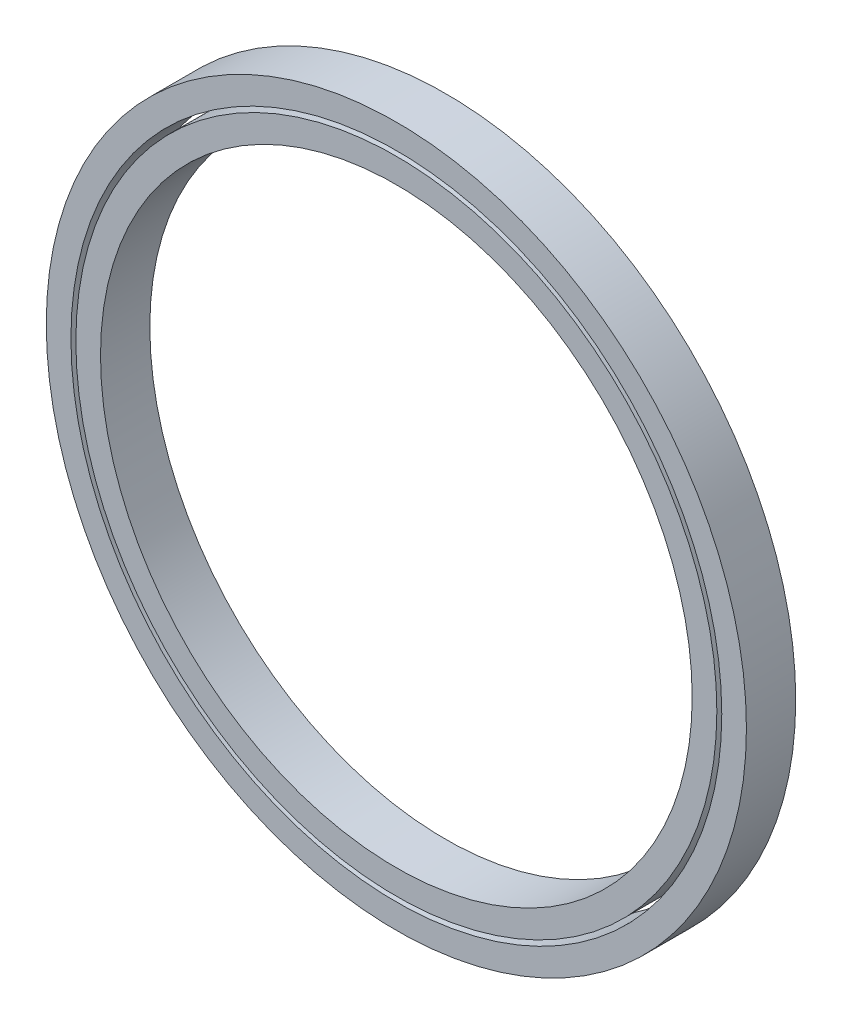
from build123d import *

# Parameters (mm, degrees)
SKETCH1_R             = 32.5
SKETCH1_R_2           = 30
BOSS_EXTRUDE1_DEPTH   = 2.5
SKETCH1_R_3           = 35.5
SKETCH1_R_4           = 33
BOSS_EXTRUDE1_2_DEPTH = 2.5


with BuildPart() as part:
    # Sketch1 → Boss-Extrude1 (new, symmetric)
    with BuildSketch(Plane.XY):
        Circle(SKETCH1_R)
        Circle(SKETCH1_R_2, mode=Mode.SUBTRACT)
    extrude(amount=BOSS_EXTRUDE1_DEPTH, both=True)


with BuildPart() as body_2:
    # Sketch1 → Boss-Extrude1 2 (new, symmetric)
    with BuildSketch(Plane.XY):
        Circle(SKETCH1_R_3)
        Circle(SKETCH1_R_4, mode=Mode.SUBTRACT)
    extrude(amount=BOSS_EXTRUDE1_2_DEPTH, both=True)


solid = Compound([part.part, body_2.part])
